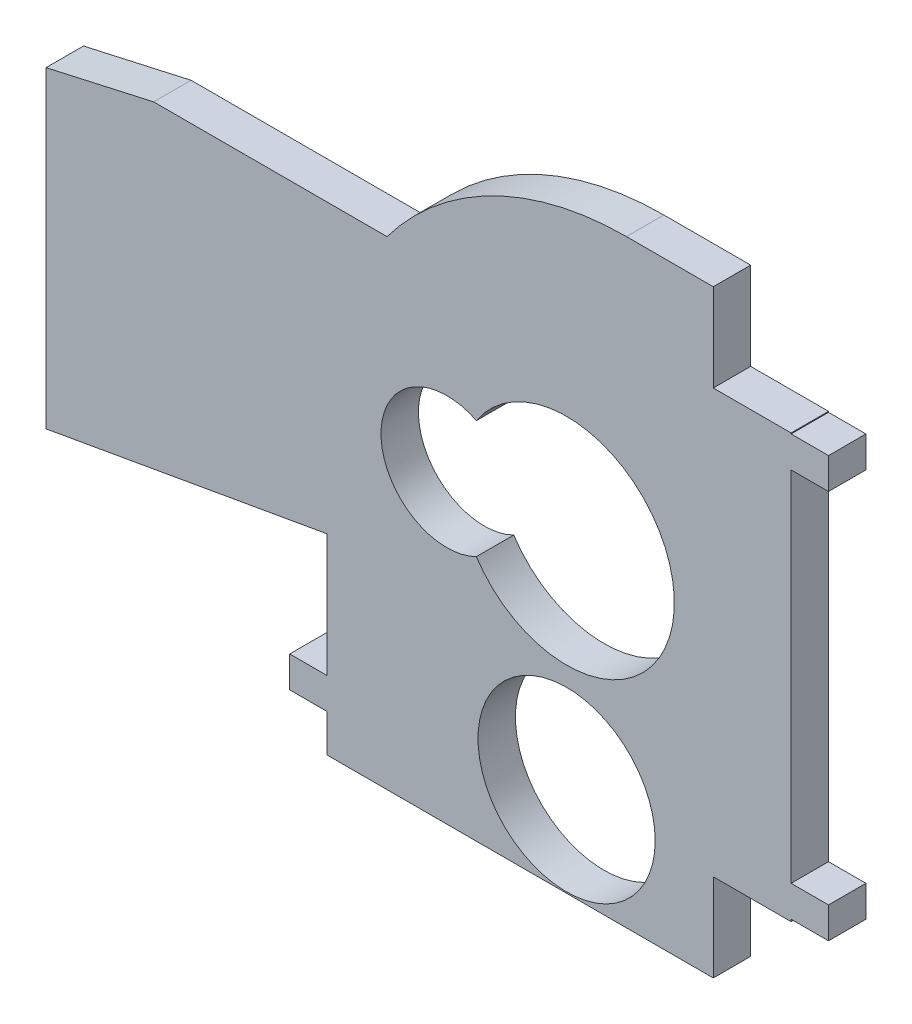
from build123d import *

# Parameters (mm, degrees)
SKETCH1_R           = 3.7592
SKETCH1_W           = 1.5875
SKETCH1_H           = 1.3208
BOSS_EXTRUDE1_DEPTH = 1.5875
CUT_EXTRUDE1_REACH  = 32.926


with BuildPart() as part:
    # Sketch1 → Boss-Extrude1 (new body)
    # profile 1 of 6: a face of its own
    with BuildSketch(Plane.XY):
        with BuildLine():
            Line((2.54, 21.59), (9.525, 21.59))
            Line((9.525, 21.59), (9.525, -3.81))
            Line((9.525, -3.81), (-10.16, -3.81))
            Line((-10.16, -3.81), (-10.16, 8.89))
            ThreePointArc((-10.16, 8.89), (-6.440256121, 17.870256121), (2.54, 21.59))
        make_face()
        Circle(SKETCH1_R, mode=Mode.SUBTRACT)
        with BuildLine():
            ThreePointArc((-3.82905, 11.642311449), (-7.874, 9.144), (-3.82905, 6.645688551))
            ThreePointArc((-3.82905, 6.645688551), (4.572, 9.144), (-3.82905, 11.642311449))
        make_face(mode=Mode.SUBTRACT)
    # profile 2 of 6: a face of its own
    with BuildSketch(Plane.XY):
        with Locations((-10.95375, -1.5494)):
            Rectangle(SKETCH1_W, SKETCH1_H)
    # profile 3 of 6: a face of its own
    with BuildSketch(Plane.XY):
        with Locations((10.31875, 17.1704)):
            Rectangle(SKETCH1_W, SKETCH1_H)
    # profile 4 of 6: a face of its own
    with BuildSketch(Plane.XY):
        with Locations((10.31875, 0.6604)):
            Rectangle(SKETCH1_W, SKETCH1_H)
    # profile 5 of 6: a face of its own
    with BuildSketch(Plane.XY):
        with BuildLine():
            ThreePointArc((-10.16, 8.89), (-9.508277885, 12.906092628), (-7.62, 16.51))
            Line((-7.62, 16.51), (-17.51946076, 16.51))
            Line((-17.51946076, 16.51), (-22.084921519, 15.486982224))
            Line((-22.084921519, 15.486982224), (-22.084921519, 13.081))
            Line((-22.084921519, 13.081), (-22.084921519, 4.699))
            Line((-22.084921519, 4.699), (-22.084921519, 2.212007412))
            Line((-22.084921519, 2.212007412), (-10.16, 4.318))
            Line((-10.16, 4.318), (-10.16, 8.89))
        make_face()
    # profile 6 of 6: a face of its own
    with BuildSketch(Plane.XY):
        with BuildLine():
            ThreePointArc((-10.16, 8.89), (-9.508277885, 12.906092628), (-7.62, 16.51))
            Line((-7.62, 16.51), (-17.51946076, 16.51))
            Line((-17.51946076, 16.51), (-22.084921519, 15.486982224))
            Line((-22.084921519, 15.486982224), (-22.084921519, 13.081))
            Line((-22.084921519, 13.081), (-22.084921519, 4.699))
            Line((-22.084921519, 4.699), (-22.084921519, 2.212007412))
            Line((-22.084921519, 2.212007412), (-10.16, 4.318))
            Line((-10.16, 4.318), (-10.16, 8.89))
        make_face()
    extrude(amount=BOSS_EXTRUDE1_DEPTH)

    # Sketch2 → Cut-Extrude1 (cut, up to next)
    with BuildSketch(Plane.XY.offset(1.5875), mode=Mode.PRIVATE) as cut_extrude1_sk1:
        Polygon((6.223, -0.0889), (6.223, -3.81), (9.525, -3.81), (9.525, -3.0226), (9.525, -0.9144), (9.525, -0.0889), align=None)
    cut_extrude1_tool1 = extrude(cut_extrude1_sk1.sketch, amount=-CUT_EXTRUDE1_REACH, mode=Mode.PRIVATE) & part.part
    # Sketch2 → Cut-Extrude1 (cut, up to next)
    with BuildSketch(Plane.XY.offset(1.5875), mode=Mode.PRIVATE) as cut_extrude1_sk2:
        Polygon((9.525, 18.6944), (9.525, 20.8026), (9.525, 21.59), (6.223, 21.59), (6.223, 17.8689), (9.525, 17.8689), align=None)
    cut_extrude1_tool2 = extrude(cut_extrude1_sk2.sketch, amount=-CUT_EXTRUDE1_REACH, mode=Mode.PRIVATE) & part.part
    add(cut_extrude1_tool1.solids().sort_by_distance((7.874, -1.94945, 1.5875))[0], mode=Mode.SUBTRACT)
    add(cut_extrude1_tool2.solids().sort_by_distance((7.874, 19.72945, 1.5875))[0], mode=Mode.SUBTRACT)


solid = part.part
